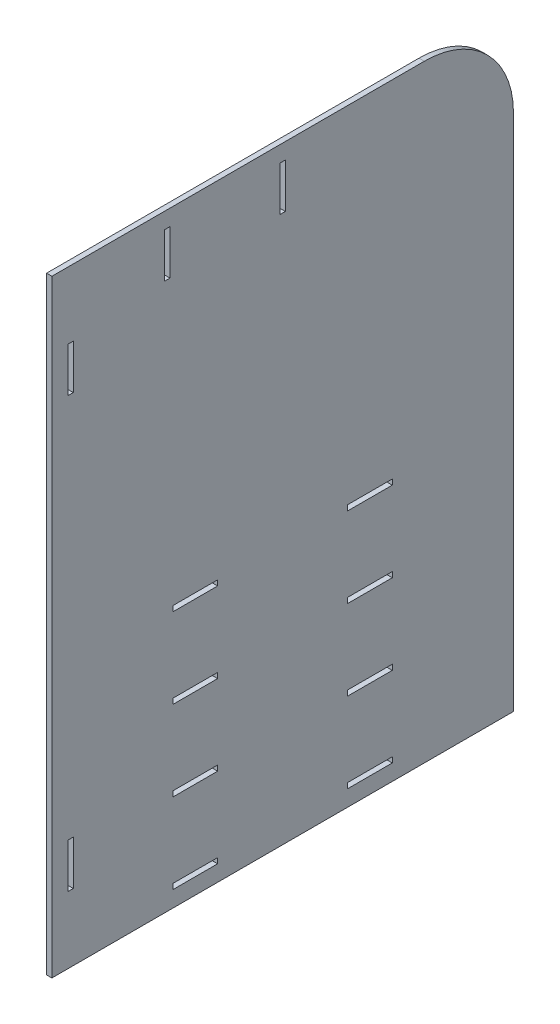
from build123d import *

# Parameters (mm, degrees)
SKETCH1_W           = 6
SKETCH1_H           = 50
SKETCH1_W_2         = 50
SKETCH1_H_2         = 6
BOSS_EXTRUDE1_DEPTH = 6


with BuildPart() as part:
    # Sketch1 → Boss-Extrude1 (new body)
    with BuildSketch(Plane(origin=(0, 0, 0), x_dir=(0, 0, -1), z_dir=(1, 0, 0))):
        with BuildLine():
            Line((-396.831767264, 351.151199882), (21.168232736, 351.151199882))
            ThreePointArc((21.168232736, 351.151199882), (91.878910855, 321.861878001), (121.168232736, 251.151199882))
            Line((121.168232736, 251.151199882), (121.168232736, -330.848800118))
            Line((121.168232736, -330.848800118), (-396.831767264, -330.848800118))
            Line((-396.831767264, -330.848800118), (-396.831767264, 351.151199882))
        make_face()
        with Locations((-375.831767264, 251.151199882)):
            Rectangle(SKETCH1_W, SKETCH1_H, mode=Mode.SUBTRACT)
        with Locations((-375.831767264, -230.848800118)):
            Rectangle(SKETCH1_W, SKETCH1_H, mode=Mode.SUBTRACT)
        with Locations((-235.831767264, -309.848800118)):
            Rectangle(SKETCH1_W_2, SKETCH1_H_2, mode=Mode.SUBTRACT)
        with Locations((-39.831767264, -309.848800118)):
            Rectangle(SKETCH1_W_2, SKETCH1_H_2, mode=Mode.SUBTRACT)
        with Locations((-235.831767264, -219.848800118)):
            Rectangle(SKETCH1_W_2, SKETCH1_H_2, mode=Mode.SUBTRACT)
        with Locations((-39.831767264, -219.848800118)):
            Rectangle(SKETCH1_W_2, SKETCH1_H_2, mode=Mode.SUBTRACT)
        with Locations((-235.831767264, -129.848800118)):
            Rectangle(SKETCH1_W_2, SKETCH1_H_2, mode=Mode.SUBTRACT)
        with Locations((-39.831767264, -129.848800118)):
            Rectangle(SKETCH1_W_2, SKETCH1_H_2, mode=Mode.SUBTRACT)
        with Locations((-235.831767264, -39.848800118)):
            Rectangle(SKETCH1_W_2, SKETCH1_H_2, mode=Mode.SUBTRACT)
        with Locations((-39.831767264, -39.848800118)):
            Rectangle(SKETCH1_W_2, SKETCH1_H_2, mode=Mode.SUBTRACT)
        with Locations((-267.331767264, 308.151199882)):
            Rectangle(SKETCH1_W, SKETCH1_H, mode=Mode.SUBTRACT)
        with Locations((-137.831767264, 308.151199882)):
            Rectangle(SKETCH1_W, SKETCH1_H, mode=Mode.SUBTRACT)
    extrude(amount=BOSS_EXTRUDE1_DEPTH)


solid = part.part
